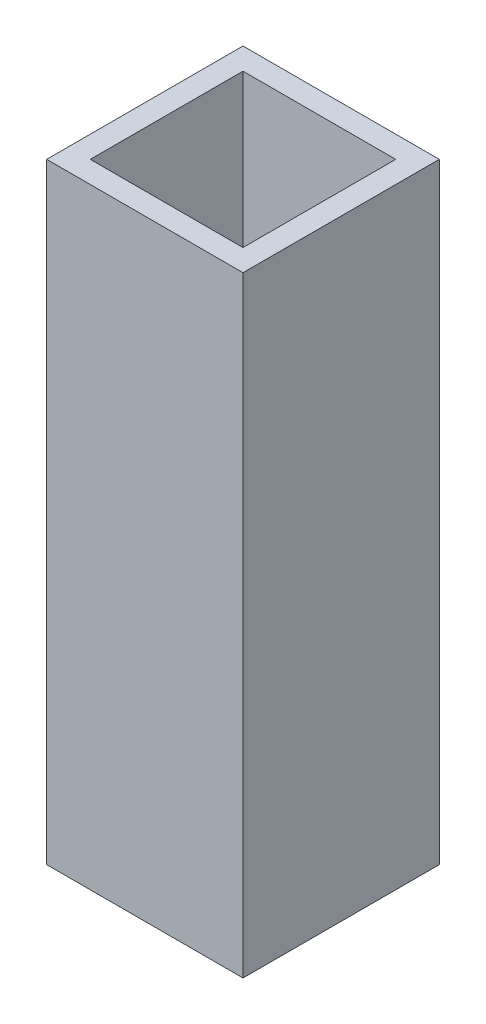
from build123d import *

# Parameters (mm, degrees)
CROQUIS1_W              = 13.5
CROQUIS1_H              = 13.5
CROQUIS1_W_2            = 10.5
CROQUIS1_H_2            = 10.5
SALIENTE_EXTRUIR1_DEPTH = 21


with BuildPart() as part:
    # Croquis1 → Saliente-Extruir1 (new, symmetric)
    with BuildSketch(Plane(origin=(0, 0, 0), x_dir=(1, 0, 0), z_dir=(0, 1, 0))):
        Rectangle(CROQUIS1_W, CROQUIS1_H)
        Rectangle(CROQUIS1_W_2, CROQUIS1_H_2, mode=Mode.SUBTRACT)
    extrude(amount=SALIENTE_EXTRUIR1_DEPTH, both=True)


solid = part.part
